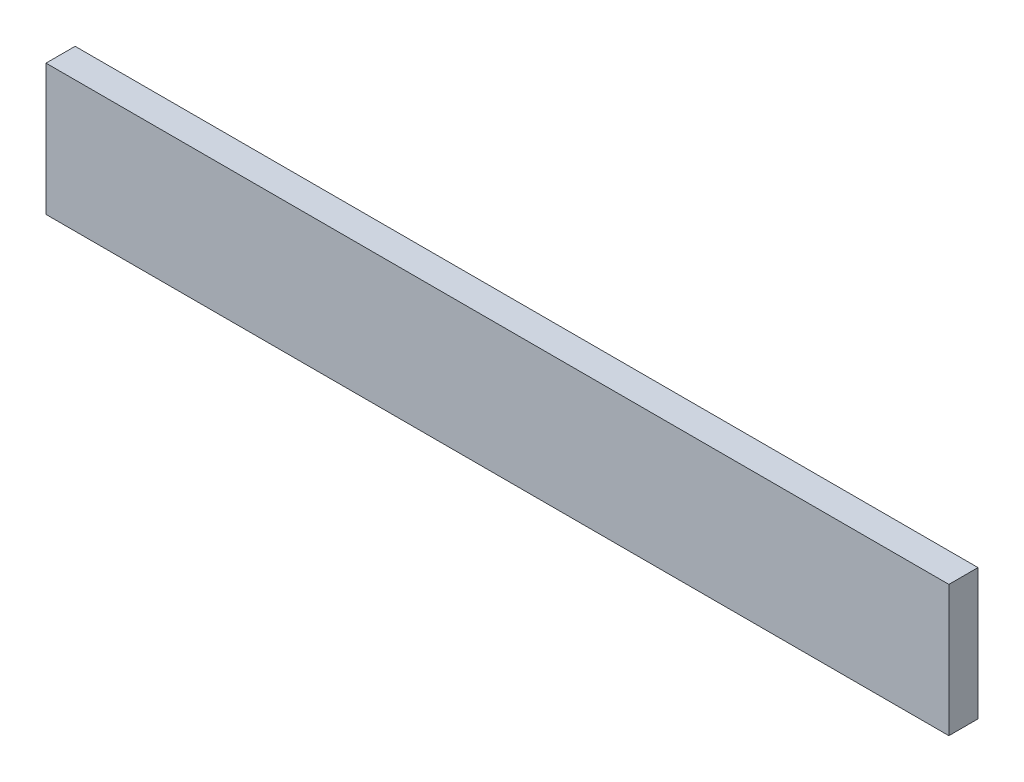
from build123d import *

# Parameters (mm, degrees)
CROQUIS1_W              = 620
CROQUIS1_H              = 90
SALIENTE_EXTRUIR1_DEPTH = 20


with BuildPart() as part:
    # Croquis1 → Saliente-Extruir1 (new body)
    with BuildSketch(Plane.XY):
        Rectangle(CROQUIS1_W, CROQUIS1_H)
    extrude(amount=SALIENTE_EXTRUIR1_DEPTH)


solid = part.part
